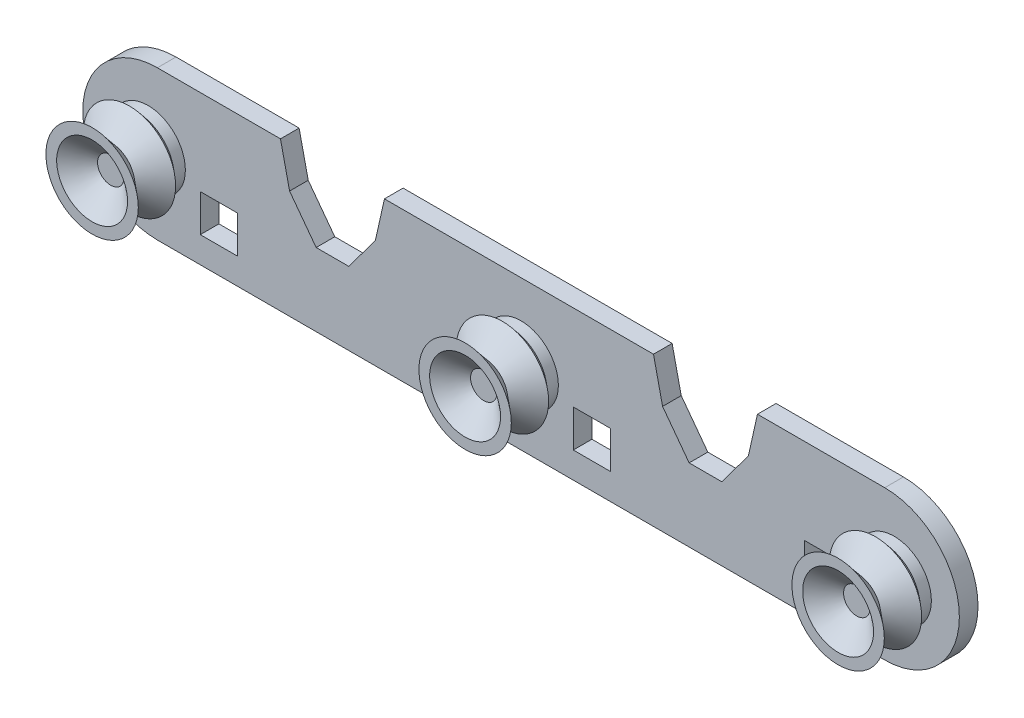
from build123d import *

# Parameters (mm, degrees)
ESQUISSE1_R                       = 5
BOSS_EXTRU_1_DEPTH                = 5
ESQUISSE2_R                       = 10
BOSS_EXTRU_2_DEPTH                = 3
ESQUISSE3_R                       = 10
BOSS_EXTRU_3_DEPTH                = 2
BOSS_EXTRU_3_DRAFT                = -50
BOSS_EXTRU_3_PROFILE_2_DEPTH      = 2
BOSS_EXTRU_3_PROFILE_2_DRAFT      = -50
BOSS_EXTRU_3_PROFILE_3_DEPTH      = 2
BOSS_EXTRU_3_PROFILE_3_DRAFT      = -50
ESQUISSE4_R                       = 12.383507185
BOSS_EXTRU_4_DEPTH                = 5
BOSS_EXTRU_4_DRAFT                = 50
BOSS_EXTRU_4_PROFILE_2_DEPTH      = 5
BOSS_EXTRU_4_PROFILE_2_DRAFT      = 50
BOSS_EXTRU_4_PROFILE_3_DEPTH      = 5
BOSS_EXTRU_4_PROFILE_3_DRAFT      = 50
ESQUISSE5_R                       = 6.424739222
BOSS_EXTRU_5_DEPTH                = 5
BOSS_EXTRU_5_DRAFT                = -50
BOSS_EXTRU_5_PROFILE_2_DEPTH      = 5
BOSS_EXTRU_5_PROFILE_2_DRAFT      = -50
BOSS_EXTRU_5_PROFILE_3_DEPTH      = 5
BOSS_EXTRU_5_PROFILE_3_DRAFT      = -50
ESQUISSE6_R                       = 9.5
ENL_V_MAT_EXTRU_1_DEPTH           = 5
ENL_V_MAT_EXTRU_1_DRAFT           = -50
ENL_V_MAT_EXTRU_1_PROFILE_2_DEPTH = 5
ENL_V_MAT_EXTRU_1_PROFILE_2_DRAFT = -50
ENL_V_MAT_EXTRU_1_PROFILE_3_DEPTH = 5
ENL_V_MAT_EXTRU_1_PROFILE_3_DRAFT = -50
ESQUISSE7_W                       = 10
ESQUISSE7_H                       = 10
ENL_V_MAT_EXTRU_2_DEPTH           = 10


with BuildPart() as part:
    # Esquisse1 → Boss.-Extru.1 (new body)
    with BuildSketch(Plane.XY):
        with BuildLine():
            Line((-98.729079498, 20), (96.270920502, 20))
            ThreePointArc((96.270920502, 20), (116.270920502, 0), (96.270920502, -20))
            Line((96.270920502, -20), (-98.729079498, -20))
            ThreePointArc((-98.729079498, -20), (-118.729079498, 0), (-98.729079498, 20))
        make_face()
        with Locations((-101.229079498, 0)):
            Circle(ESQUISSE1_R, mode=Mode.SUBTRACT)
        with Locations((-1.229079498, 0)):
            Circle(ESQUISSE1_R, mode=Mode.SUBTRACT)
        with Locations((98.770920502, 0)):
            Circle(ESQUISSE1_R, mode=Mode.SUBTRACT)
    extrude(amount=BOSS_EXTRU_1_DEPTH)

    # Esquisse2 → Boss.-Extru.2 (add)
    with BuildSketch(Plane.XY.offset(5)):
        with Locations((-101.229079498, 0)):
            Circle(ESQUISSE2_R)
        with Locations((-1.229079498, 0)):
            Circle(ESQUISSE2_R)
        with Locations((98.770920502, 0)):
            Circle(ESQUISSE2_R)
    extrude(amount=BOSS_EXTRU_2_DEPTH)


with BuildPart() as boss_extru_3_tool:
    # Esquisse3 → Boss.-Extru.3 (with draft: the straight prism first)
    with BuildSketch(Plane.XY.offset(8)):
        with Locations((-101.229079498, 0)):
            Circle(ESQUISSE3_R)
    extrude(amount=BOSS_EXTRU_3_DEPTH)
    # Boss.-Extru.3: the draft: its side faces are tilted about the plane it starts from
    boss_extru_3_sides = [boss_extru_3_tool.faces().sort_by_distance(p)[0] for p in [
        (-111.229079498, 0, 9),
    ]]
    draft(boss_extru_3_sides, Plane.XY.offset(8), BOSS_EXTRU_3_DRAFT)


with BuildPart() as part_1:
    add(part.part)

    # Boss.-Extru.3: add boss_extru_3_tool
    add(boss_extru_3_tool.part)


with BuildPart() as boss_extru_3_profile_2_tool:
    # Esquisse3 → Boss.-Extru.3 profile 2 (with draft: the straight prism first)
    with BuildSketch(Plane.XY.offset(8)):
        with Locations((-1.229079498, 0)):
            Circle(ESQUISSE3_R)
    extrude(amount=BOSS_EXTRU_3_PROFILE_2_DEPTH)
    # Boss.-Extru.3 profile 2: the draft: its side faces are tilted about the plane it starts from
    boss_extru_3_profile_2_sides = [boss_extru_3_profile_2_tool.faces().sort_by_distance(p)[0] for p in [
        (-11.229079498, 0, 9),
    ]]
    draft(boss_extru_3_profile_2_sides, Plane.XY.offset(8), BOSS_EXTRU_3_PROFILE_2_DRAFT)


with BuildPart() as part_2:
    add(part_1.part)

    # Boss.-Extru.3 profile 2: add boss_extru_3_profile_2_tool
    add(boss_extru_3_profile_2_tool.part)


with BuildPart() as boss_extru_3_profile_3_tool:
    # Esquisse3 → Boss.-Extru.3 profile 3 (with draft: the straight prism first)
    with BuildSketch(Plane.XY.offset(8)):
        with Locations((98.770920502, 0)):
            Circle(ESQUISSE3_R)
    extrude(amount=BOSS_EXTRU_3_PROFILE_3_DEPTH)
    # Boss.-Extru.3 profile 3: the draft: its side faces are tilted about the plane it starts from
    boss_extru_3_profile_3_sides = [boss_extru_3_profile_3_tool.faces().sort_by_distance(p)[0] for p in [
        (88.770920502, 0, 9),
    ]]
    draft(boss_extru_3_profile_3_sides, Plane.XY.offset(8), BOSS_EXTRU_3_PROFILE_3_DRAFT)


with BuildPart() as part_3:
    add(part_2.part)

    # Boss.-Extru.3 profile 3: add boss_extru_3_profile_3_tool
    add(boss_extru_3_profile_3_tool.part)


with BuildPart() as boss_extru_4_tool:
    # Esquisse4 → Boss.-Extru.4 (with draft: the straight prism first)
    with BuildSketch(Plane.XY.offset(10)):
        with Locations((-101.229079498, 0)):
            Circle(ESQUISSE4_R)
    extrude(amount=BOSS_EXTRU_4_DEPTH)
    # Boss.-Extru.4: the draft: its side faces are tilted about the plane it starts from
    boss_extru_4_sides = [boss_extru_4_tool.faces().sort_by_distance(p)[0] for p in [
        (-113.612586683, 0, 12.5),
    ]]
    draft(boss_extru_4_sides, Plane.XY.offset(10), BOSS_EXTRU_4_DRAFT)


with BuildPart() as part_4:
    add(part_3.part)

    # Boss.-Extru.4: add boss_extru_4_tool
    add(boss_extru_4_tool.part)


with BuildPart() as boss_extru_4_profile_2_tool:
    # Esquisse4 → Boss.-Extru.4 profile 2 (with draft: the straight prism first)
    with BuildSketch(Plane.XY.offset(10)):
        with Locations((-1.229079498, 0)):
            Circle(ESQUISSE4_R)
    extrude(amount=BOSS_EXTRU_4_PROFILE_2_DEPTH)
    # Boss.-Extru.4 profile 2: the draft: its side faces are tilted about the plane it starts from
    boss_extru_4_profile_2_sides = [boss_extru_4_profile_2_tool.faces().sort_by_distance(p)[0] for p in [
        (-13.612586683, 0, 12.5),
    ]]
    draft(boss_extru_4_profile_2_sides, Plane.XY.offset(10), BOSS_EXTRU_4_PROFILE_2_DRAFT)


with BuildPart() as part_5:
    add(part_4.part)

    # Boss.-Extru.4 profile 2: add boss_extru_4_profile_2_tool
    add(boss_extru_4_profile_2_tool.part)


with BuildPart() as boss_extru_4_profile_3_tool:
    # Esquisse4 → Boss.-Extru.4 profile 3 (with draft: the straight prism first)
    with BuildSketch(Plane.XY.offset(10)):
        with Locations((98.770920502, 0)):
            Circle(ESQUISSE4_R)
    extrude(amount=BOSS_EXTRU_4_PROFILE_3_DEPTH)
    # Boss.-Extru.4 profile 3: the draft: its side faces are tilted about the plane it starts from
    boss_extru_4_profile_3_sides = [boss_extru_4_profile_3_tool.faces().sort_by_distance(p)[0] for p in [
        (86.387413317, 0, 12.5),
    ]]
    draft(boss_extru_4_profile_3_sides, Plane.XY.offset(10), BOSS_EXTRU_4_PROFILE_3_DRAFT)


with BuildPart() as part_6:
    add(part_5.part)

    # Boss.-Extru.4 profile 3: add boss_extru_4_profile_3_tool
    add(boss_extru_4_profile_3_tool.part)


with BuildPart() as boss_extru_5_tool:
    # Esquisse5 → Boss.-Extru.5 (with draft: the straight prism first)
    with BuildSketch(Plane.XY.offset(15)):
        with Locations((-101.229079498, 0)):
            Circle(ESQUISSE5_R)
    extrude(amount=BOSS_EXTRU_5_DEPTH)
    # Boss.-Extru.5: the draft: its side faces are tilted about the plane it starts from
    boss_extru_5_sides = [boss_extru_5_tool.faces().sort_by_distance(p)[0] for p in [
        (-107.65381872, 0, 17.5),
    ]]
    draft(boss_extru_5_sides, Plane.XY.offset(15), BOSS_EXTRU_5_DRAFT)


with BuildPart() as part_7:
    add(part_6.part)

    # Boss.-Extru.5: add boss_extru_5_tool
    add(boss_extru_5_tool.part)


with BuildPart() as boss_extru_5_profile_2_tool:
    # Esquisse5 → Boss.-Extru.5 profile 2 (with draft: the straight prism first)
    with BuildSketch(Plane.XY.offset(15)):
        with Locations((-1.229079498, 0)):
            Circle(ESQUISSE5_R)
    extrude(amount=BOSS_EXTRU_5_PROFILE_2_DEPTH)
    # Boss.-Extru.5 profile 2: the draft: its side faces are tilted about the plane it starts from
    boss_extru_5_profile_2_sides = [boss_extru_5_profile_2_tool.faces().sort_by_distance(p)[0] for p in [
        (-7.65381872, 0, 17.5),
    ]]
    draft(boss_extru_5_profile_2_sides, Plane.XY.offset(15), BOSS_EXTRU_5_PROFILE_2_DRAFT)


with BuildPart() as part_8:
    add(part_7.part)

    # Boss.-Extru.5 profile 2: add boss_extru_5_profile_2_tool
    add(boss_extru_5_profile_2_tool.part)


with BuildPart() as boss_extru_5_profile_3_tool:
    # Esquisse5 → Boss.-Extru.5 profile 3 (with draft: the straight prism first)
    with BuildSketch(Plane.XY.offset(15)):
        with Locations((98.770920502, 0)):
            Circle(ESQUISSE5_R)
    extrude(amount=BOSS_EXTRU_5_PROFILE_3_DEPTH)
    # Boss.-Extru.5 profile 3: the draft: its side faces are tilted about the plane it starts from
    boss_extru_5_profile_3_sides = [boss_extru_5_profile_3_tool.faces().sort_by_distance(p)[0] for p in [
        (92.34618128, 0, 17.5),
    ]]
    draft(boss_extru_5_profile_3_sides, Plane.XY.offset(15), BOSS_EXTRU_5_PROFILE_3_DRAFT)


with BuildPart() as part_9:
    add(part_8.part)

    # Boss.-Extru.5 profile 3: add boss_extru_5_profile_3_tool
    add(boss_extru_5_profile_3_tool.part)


with BuildPart() as enl_v_mat_extru_1_tool:
    # Esquisse6 → Enlèv. mat.-Extru.1 (with draft: the straight prism first)
    with BuildSketch(Plane.XY.offset(20)):
        with Locations((-101.229079498, 0)):
            Circle(ESQUISSE6_R)
    extrude(amount=-ENL_V_MAT_EXTRU_1_DEPTH)
    # Enlèv. mat.-Extru.1: the draft: its side faces are tilted about the plane it starts from
    enl_v_mat_extru_1_sides = [enl_v_mat_extru_1_tool.faces().sort_by_distance(p)[0] for p in [
        (-110.729079498, 0, 17.5),
    ]]
    draft(enl_v_mat_extru_1_sides, Plane.XY.offset(20), ENL_V_MAT_EXTRU_1_DRAFT)


with BuildPart() as part_10:
    add(part_9.part)

    # Enlèv. mat.-Extru.1: cut by enl_v_mat_extru_1_tool
    add(enl_v_mat_extru_1_tool.part, mode=Mode.SUBTRACT)


with BuildPart() as enl_v_mat_extru_1_profile_2_tool:
    # Esquisse6 → Enlèv. mat.-Extru.1 profile 2 (with draft: the straight prism first)
    with BuildSketch(Plane.XY.offset(20)):
        with Locations((-1.229079498, 0)):
            Circle(ESQUISSE6_R)
    extrude(amount=-ENL_V_MAT_EXTRU_1_PROFILE_2_DEPTH)
    # Enlèv. mat.-Extru.1 profile 2: the draft: its side faces are tilted about the plane it starts from
    enl_v_mat_extru_1_profile_2_sides = [enl_v_mat_extru_1_profile_2_tool.faces().sort_by_distance(p)[0] for p in [
        (-10.729079498, 0, 17.5),
    ]]
    draft(enl_v_mat_extru_1_profile_2_sides, Plane.XY.offset(20), ENL_V_MAT_EXTRU_1_PROFILE_2_DRAFT)


with BuildPart() as part_11:
    add(part_10.part)

    # Enlèv. mat.-Extru.1 profile 2: cut by enl_v_mat_extru_1_profile_2_tool
    add(enl_v_mat_extru_1_profile_2_tool.part, mode=Mode.SUBTRACT)


with BuildPart() as enl_v_mat_extru_1_profile_3_tool:
    # Esquisse6 → Enlèv. mat.-Extru.1 profile 3 (with draft: the straight prism first)
    with BuildSketch(Plane.XY.offset(20)):
        with Locations((98.770920502, 0)):
            Circle(ESQUISSE6_R)
    extrude(amount=-ENL_V_MAT_EXTRU_1_PROFILE_3_DEPTH)
    # Enlèv. mat.-Extru.1 profile 3: the draft: its side faces are tilted about the plane it starts from
    enl_v_mat_extru_1_profile_3_sides = [enl_v_mat_extru_1_profile_3_tool.faces().sort_by_distance(p)[0] for p in [
        (89.270920502, 0, 17.5),
    ]]
    draft(enl_v_mat_extru_1_profile_3_sides, Plane.XY.offset(20), ENL_V_MAT_EXTRU_1_PROFILE_3_DRAFT)


with BuildPart() as part_12:
    add(part_11.part)

    # Enlèv. mat.-Extru.1 profile 3: cut by enl_v_mat_extru_1_profile_3_tool
    add(enl_v_mat_extru_1_profile_3_tool.part, mode=Mode.SUBTRACT)

    # Esquisse7 → Enlèv. mat.-Extru.2 (cut)
    with BuildSketch(Plane(origin=(0, 0, 0), x_dir=(-1, 0, 0), z_dir=(0, 0, -1))):
        with Locations((-79.770920502, -8)):
            Rectangle(ESQUISSE7_W, ESQUISSE7_H)
        Polygon((65.729079498, 20), (63.290744845, 9.096400069), (56.165717759, -0.455876038), (51.791778882, -0.455876038), (47.417840004, -0.455876038), (40.292812918, 9.096400069), (37.854478265, 20), align=None)
        with Locations((-17.770920502, -8)):
            Rectangle(ESQUISSE7_W, ESQUISSE7_H)
        with Locations((82.229079498, -8)):
            Rectangle(ESQUISSE7_W, ESQUISSE7_H)
        Polygon((-36.709255155, 9.096400069), (-43.834282241, -0.455876038), (-48.208221118, -0.455876038), (-52.582159996, -0.455876038), (-59.707187082, 9.096400069), (-62.145521735, 20), (-34.270920502, 20), align=None)
    extrude(amount=-ENL_V_MAT_EXTRU_2_DEPTH, mode=Mode.SUBTRACT)


solid = part_12.part
